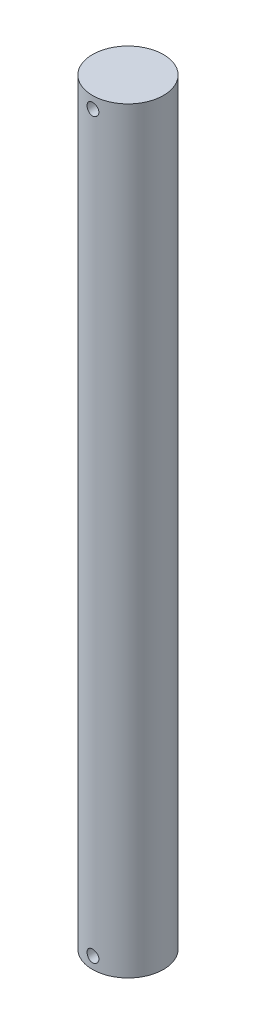
from build123d import *

# Parameters (mm, degrees)
SKETCH1_R               = 30
BOSS_EXTRUDE1_DEPTH     = 640
CUT_EXTRUDE1_DEPTH      = 642.404708433
CUT_EXTRUDE1_DEPTH_BACK = 642.404708433
SKETCH2_R               = 5


with BuildPart() as part:
    # Sketch1 → Boss-Extrude1 (new body)
    with BuildSketch(Plane(origin=(0, 0, 0), x_dir=(1, 0, 0), z_dir=(0, 1, 0))):
        with Locations(Location((0, 0, 0), (0, 0, 270))):
            Circle(SKETCH1_R)
    extrude(amount=BOSS_EXTRUDE1_DEPTH)

    # Sketch2 → Cut-Extrude1 (cut, two sides: drawn at the far end of the back side and taken through both)
    with BuildSketch(Plane.XY.offset(-CUT_EXTRUDE1_DEPTH_BACK)):
        with Locations((0, 630)):
            Circle(SKETCH2_R)
        with Locations((0, 10)):
            Circle(SKETCH2_R)
    extrude(amount=CUT_EXTRUDE1_DEPTH + CUT_EXTRUDE1_DEPTH_BACK, mode=Mode.SUBTRACT)


solid = part.part
